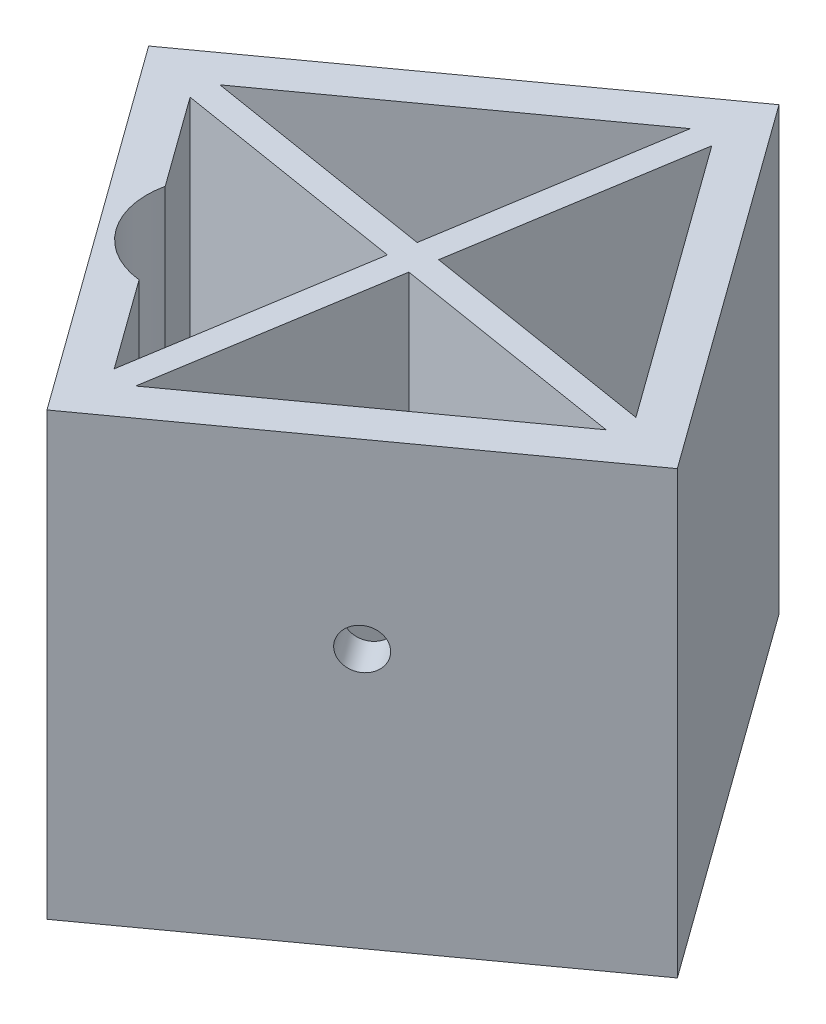
from build123d import *

# Parameters (mm, degrees)
SKETCH1_R           = 1.5
BOSS_EXTRUDE2_DEPTH = 2.54
BOSS_EXTRUDE3_DEPTH = 19.05
BOSS_EXTRUDE6_DEPTH = 19.05
SKETCH4_R           = 1
CUT_EXTRUDE1_DEPTH  = 158.597711186
FILLET1_R           = 6.35


with BuildPart() as part:
    # Sketch1 → Boss-Extrude2 (new body)
    with BuildSketch(Plane(origin=(0, 0, 0), x_dir=(1, 0, 0), z_dir=(0, 1, 0))):
        Polygon((-93.521103592, -81.172331094), (-106.459273851, -63.257941504), (-124.37366344, -76.196111763), (-111.435493182, -94.110501353), align=None)
        with Locations(Location((-114.3, -82.55, 0), (0, 0, 270))):
            Circle(SKETCH1_R, mode=Mode.SUBTRACT)
    extrude(amount=BOSS_EXTRUDE2_DEPTH)

    # Sketch2 → Boss-Extrude3 (add)
    with BuildSketch(Plane(origin=(0, 2.54, 0), x_dir=(1, 0, 0), z_dir=(0, 1, 0))):
        Polygon((-106.459273851, -63.257941504), (-124.37366344, -76.196111763), (-111.435493182, -94.110501353), (-93.521103592, -81.172331094), align=None)
        with BuildLine():
            Line((-106.888258276, -65.91764494), (-121.713960005, -76.625096188))
            Line((-121.713960005, -76.625096188), (-118.022197338, -81.736767574))
            ThreePointArc((-118.022197338, -81.736767574), (-117.38868786, -84.78071901), (-114.698271424, -86.339126532))
            Line((-114.698271424, -86.339126532), (-111.006508757, -91.450797917))
            Line((-111.006508757, -91.450797917), (-96.180807028, -80.743346669))
            Line((-96.180807028, -80.743346669), (-106.888258276, -65.91764494))
        make_face(mode=Mode.SUBTRACT)
    extrude(amount=BOSS_EXTRUDE3_DEPTH)

    # Sketch3 → Boss-Extrude6 (add)
    with BuildSketch(Plane(origin=(0, 21.59, 0), x_dir=(1, 0, 0), z_dir=(0, 1, 0))):
        Polygon((-121.713960005, -76.625096188), (-121.188174492, -77.353106899), (-109.675394227, -79.210006941), (-111.53229427, -90.722787207), (-111.006508757, -91.450797917), (-110.278498046, -90.925012404), (-108.421598003, -79.412232139), (-96.908817738, -81.269132182), (-96.180807028, -80.743346669), (-96.706592541, -80.015335958), (-108.219372806, -78.158435915), (-106.362472763, -66.64565565), (-106.888258276, -65.91764494), (-107.616268987, -66.443430453), (-109.473169029, -77.956210718), (-120.985949295, -76.099310675), align=None)
    extrude(amount=-BOSS_EXTRUDE6_DEPTH)

    # Sketch4 → Cut-Extrude1 (cut, through all)
    with BuildSketch(Plane(origin=(6.469085129, 0, 8.957194795), x_dir=(0.8106792283998809, 0, -0.5854905538443587), z_dir=(0.5854905538443586, 0, 0.8106792283998808))):
        with Locations(Location((-134.390249188, 12.7, 0), (0, 0, 90))):
            Circle(SKETCH4_R)
    extrude(amount=-CUT_EXTRUDE1_DEPTH, mode=Mode.SUBTRACT)

    # Fillet1
    fillet1_edges = [part.edges().sort_by_distance(p)[0] for p in [
        (-103.593657892, 2.54, 86.097072293),
        (-114.301109141, 2.54, 71.271370564),
    ]]
    fillet(fillet1_edges, radius=FILLET1_R)


solid = part.part
